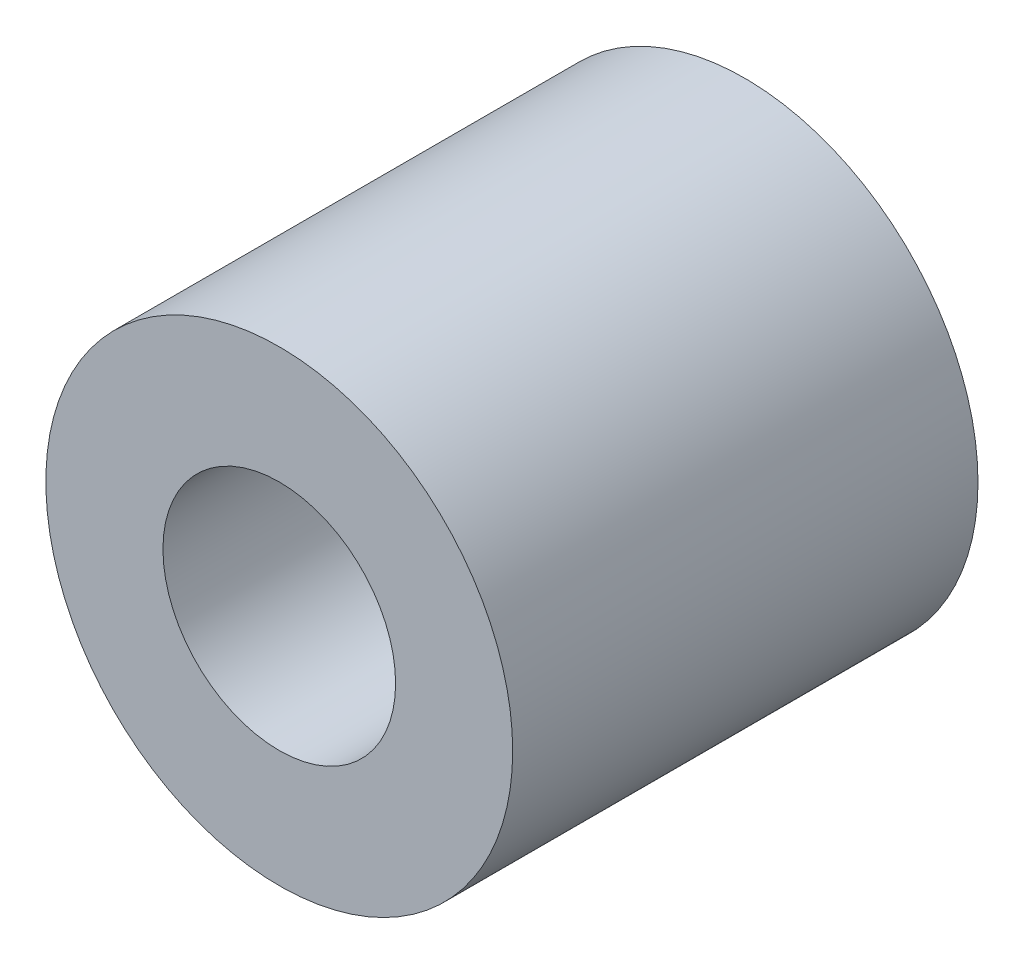
from build123d import *

# Parameters (mm, degrees)
SKETCH1_R      = 3.01
SKETCH1_R_2    = 1.5
EXTRUDE1_DEPTH = 3


with BuildPart() as part:
    # Sketch1 → Extrude1 (new, symmetric)
    with BuildSketch(Plane.XY):
        Circle(SKETCH1_R)
        Circle(SKETCH1_R_2, mode=Mode.SUBTRACT)
    extrude(amount=EXTRUDE1_DEPTH, both=True)


solid = part.part
